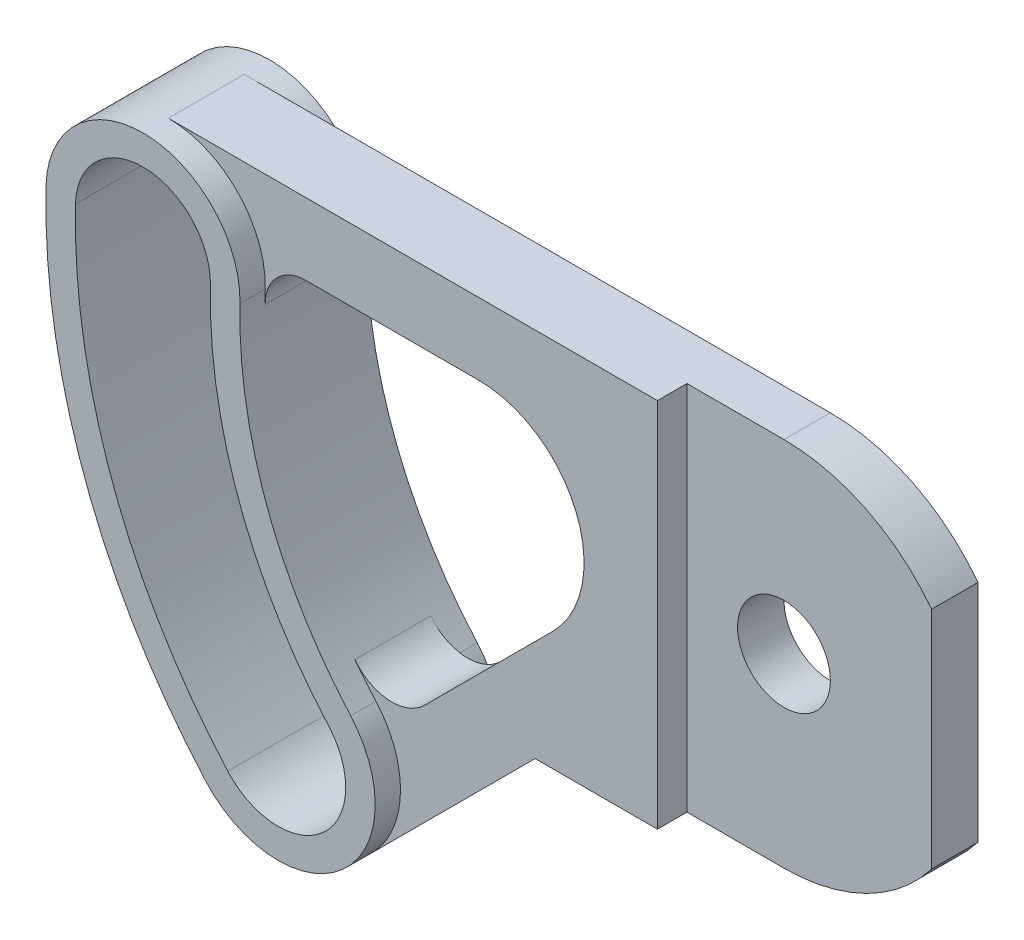
from build123d import *
from build123d.topology import SkipClean

# Parameters (mm, degrees)
BOSS_EXTRUDE1_DEPTH = 15
BOSS_EXTRUDE2_DEPTH = 9
BOSS_EXTRUDE3_START = -3.5
SKETCH1_4_R         = 11
BOSS_EXTRUDE3_DEPTH = 5.5


with BuildPart() as part:
    # Sketch1 → Boss-Extrude1 (new, symmetric)
    with BuildSketch(Plane.XY):
        with BuildLine():
            ThreePointArc((-124.10035648, -81.666995927), (-107.585956399, -89.374836112), (-90.648179186, -82.648179186))
            ThreePointArc((-90.648179186, -82.648179186), (-83.921522259, -67.059044464), (-89.722913826, -51.102450509))
            ThreePointArc((-89.722913826, -51.102450509), (-92.277527324, -48.11746068), (-94.717571561, -45.038110339))
            ThreePointArc((-94.717571561, -45.038110339), (-110.416127663, -15.619426166), (-115.997334395, 17.255393583))
            ThreePointArc((-115.997334395, 17.255393583), (-115.99647598, 18.856144662), (-115.970979893, 20.456692913))
            ThreePointArc((-115.970979893, 20.456692913), (-122.51013913, 37.070219927), (-138.964561985, 44))
            ThreePointArc((-138.964561985, 44), (-155.034781912, 37.454422855), (-161.958144077, 21.543307087))
            ThreePointArc((-161.958144077, 21.543307087), (-152.82526794, -33.65504728), (-124.10035648, -81.666995927))
        make_face()
        with BuildLine():
            ThreePointArc((-118.869006511, -77.01586945), (-146.253422103, -31.244478407), (-154.960097353, 21.377952756))
            ThreePointArc((-154.960097353, 21.377952756), (-138.586609229, 36.995535368), (-122.969026617, 20.622047244))
            ThreePointArc((-122.969026617, 20.622047244), (-116.210698276, -20.224734987), (-94.954263795, -55.753576986))
            ThreePointArc((-94.954263795, -55.753576986), (-96.280488921, -78.342094576), (-118.869006511, -77.01586945))
        make_face(mode=Mode.SUBTRACT)
    extrude(amount=BOSS_EXTRUDE1_DEPTH, both=True)

    # Sketch1<3> → Boss-Extrude2 (add, symmetric)
    with SkipClean():  # the faces are left unmerged after this step: merging them gives an invalid solid
        with BuildSketch(Plane.XY):
            with BuildLine():
                Line((-52, -44), (-23, -44))
                Line((-23, -44), (-23, 44))
                Line((-23, 44), (-138.964561985, 44))
                ThreePointArc((-138.964561985, 44), (-122.51013913, 37.070219927), (-115.970979893, 20.456692913))
                ThreePointArc((-115.970979893, 20.456692913), (-115.99647598, 18.856144662), (-115.997334395, 17.255393583))
                ThreePointArc((-115.997334395, 17.255393583), (-113.188190384, 24.141624797), (-106.322248233, 27))
                Line((-106.322248233, 27), (-65.39696962, 27))
                ThreePointArc((-65.39696962, 27), (-42.299981307, 11.567085809), (-47.71930009, -15.67766953))
                Line((-47.71930009, -15.67766953), (-78.190423053, -46.148792492))
                ThreePointArc((-78.190423053, -46.148792492), (-86.706172416, -49.345862018), (-94.717571561, -45.038110339))
                ThreePointArc((-94.717571561, -45.038110339), (-92.277527324, -48.11746068), (-89.722913826, -51.102450509))
                ThreePointArc((-89.722913826, -51.102450509), (-83.921522259, -67.059044464), (-90.648179186, -82.648179186))
                Line((-90.648179186, -82.648179186), (-52, -44))
            make_face()
        extrude(amount=BOSS_EXTRUDE2_DEPTH, both=True)

    # Sketch1<4> → Boss-Extrude3 (add, symmetric)
    with SkipClean():  # the faces are left unmerged after this step: merging them gives an invalid solid
        with BuildSketch(Plane.XY.offset(BOSS_EXTRUDE3_START)):
            with BuildLine():
                Line((-23, -44), (0, -44))
                ThreePointArc((0, -44), (19.528931575, -39.428680317), (35, -26.664583252))
                Line((35, -26.664583252), (35, 26.664583252))
                ThreePointArc((35, 26.664583252), (19.528931575, 39.428680317), (0, 44))
                Line((0, 44), (-23, 44))
                Line((-23, 44), (-23, -44))
            make_face()
            Circle(SKETCH1_4_R, mode=Mode.SUBTRACT)
        extrude(amount=BOSS_EXTRUDE3_DEPTH, both=True)


solid = part.part
